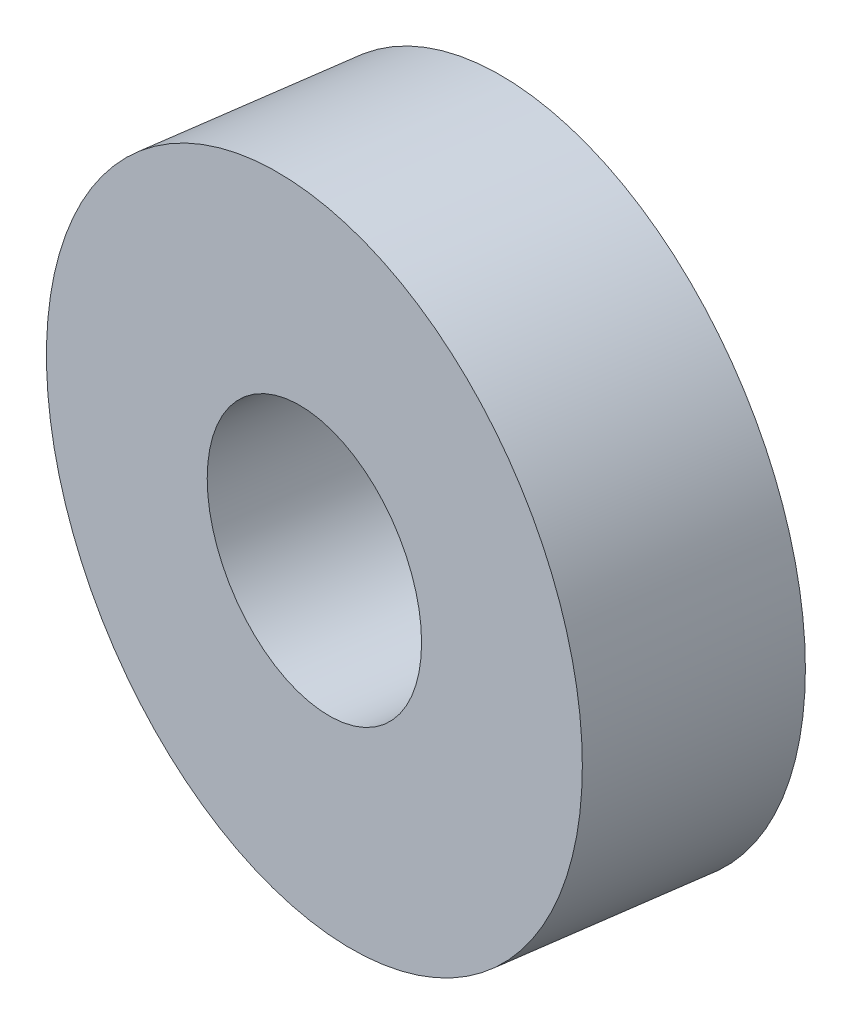
from build123d import *

# Parameters (mm, degrees)
SKETCH1_W = 4.9784
SKETCH1_H = 4.7625


with BuildPart() as part:
    # Sketch1 → Revolve1 (revolve)
    with BuildSketch(Plane(origin=(-29.473592452, 0, 32.555243324), x_dir=(0.13925483139909503, 0, -0.9902565788380351), z_dir=(0.9902565788380351, 0, 0.13925483139909503)), mode=Mode.PRIVATE) as revolve1_sk:
        with Locations((47.726681452, -16.69215516)):
            Rectangle(SKETCH1_W, SKETCH1_H)
    revolve(revolve1_sk.sketch.rotate(Axis((-23.1740546, -11.13590516, -12.241470294), (0.13925483139909514, 0, -0.9902565788380351)), 270), axis=Axis((-23.1740546, -11.13590516, -12.241470294), (0.13925483139909514, 0, -0.9902565788380351)))


solid = part.part
